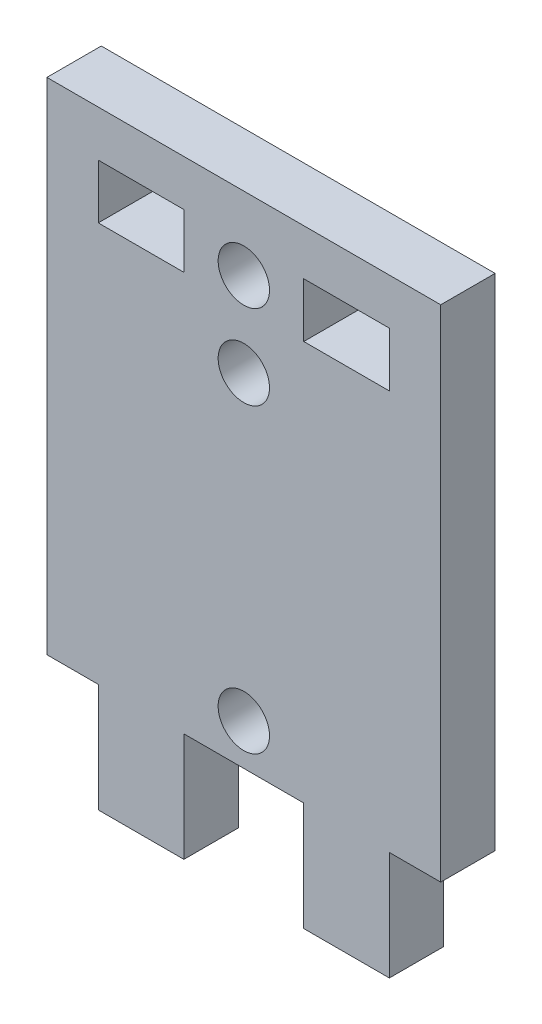
from build123d import *

# Parameters (mm, degrees)
BOSS_EXTRUDE1_DEPTH = 3.175
SKETCH2_R           = 1.5
CUT_EXTRUDE1_DEPTH  = 22.594689741
SKETCH3_R           = 1.5
SKETCH3_W           = 5
SKETCH3_H           = 3.175
CUT_EXTRUDE2_DEPTH  = 22.594689741


with BuildPart() as part:
    # Sketch1 → Boss-Extrude1 (new body)
    with BuildSketch(Plane.XY):
        Polygon((-11.5, 0), (-11.5, -11.2), (-8.5, -11.2), (-8.5, -17.55), (-3.5, -17.55), (-3.5, -11.2), (3.5, -11.2), (3.5, -17.55), (8.5, -17.55), (8.5, -11.2), (11.5, -11.2), (11.5, 0), (11.5, 18), (-11.5, 18), align=None)
    extrude(amount=BOSS_EXTRUDE1_DEPTH)

    # Sketch2 → Cut-Extrude1 (cut, through all)
    with BuildSketch(Plane.XY.offset(3.175)):
        with Locations((0, -8.8)):
            Circle(SKETCH2_R)
        with Locations(Location((0, 8.8, 0), (0, 0, 180))):
            Circle(SKETCH2_R)
    extrude(amount=-CUT_EXTRUDE1_DEPTH, mode=Mode.SUBTRACT)

    # Sketch3 → Cut-Extrude2 (cut, through all)
    with BuildSketch(Plane.XY.offset(3.175)):
        with Locations((0, 13.72908257)):
            Circle(SKETCH3_R)
        with Locations((6, 13.72908257)):
            Rectangle(SKETCH3_W, SKETCH3_H)
        with Locations((-6, 13.72908257)):
            Rectangle(SKETCH3_W, SKETCH3_H)
    extrude(amount=-CUT_EXTRUDE2_DEPTH, mode=Mode.SUBTRACT)


solid = part.part
